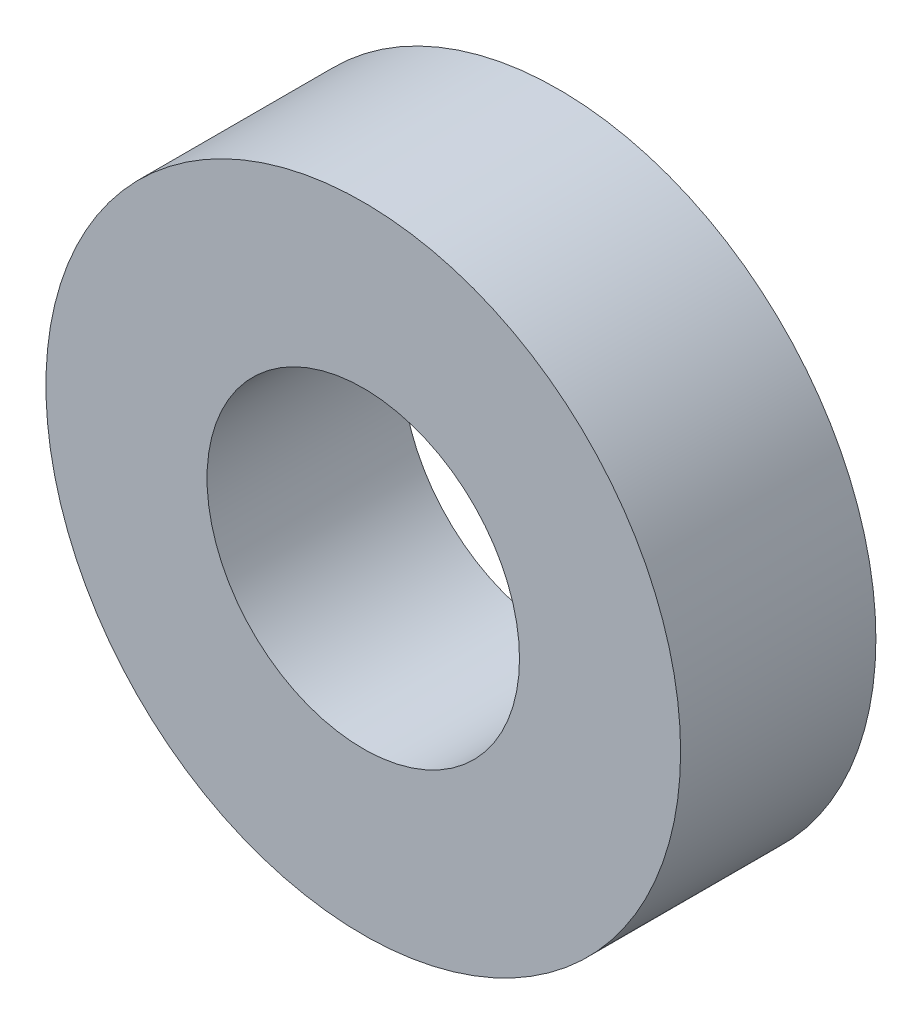
from build123d import *

# Parameters (mm, degrees)
SKETCH_1_R      = 6.5
SKETCH_1_R_2    = 3.2
EXTRUDE_1_DEPTH = 4


with BuildPart() as part:
    # 草图1 → 凸台-拉伸1 (new body)
    with BuildSketch(Plane.XY):
        Circle(SKETCH_1_R)
        Circle(SKETCH_1_R_2, mode=Mode.SUBTRACT)
    extrude(amount=EXTRUDE_1_DEPTH)


solid = part.part
